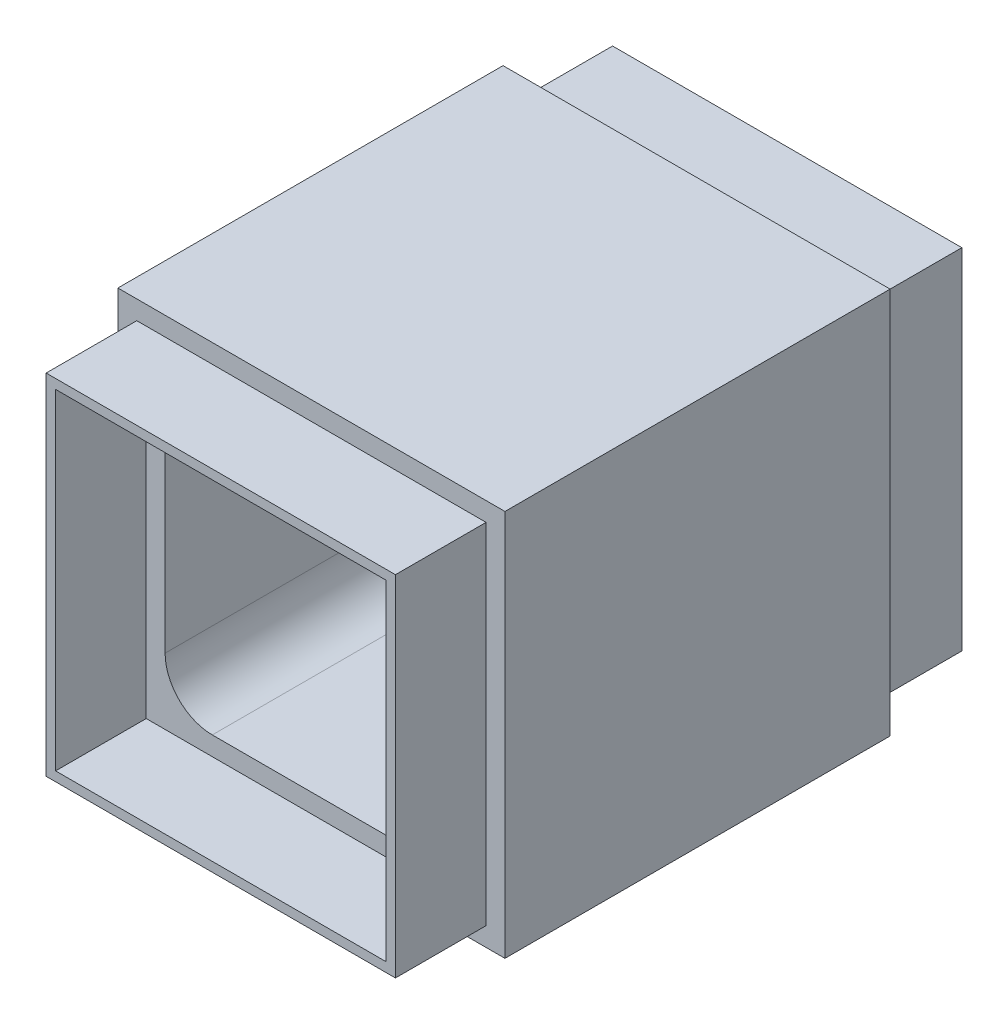
from build123d import *

# Parameters (mm, degrees)
SKETCH1_W           = 52.07
SKETCH1_H           = 52.07
BOSS_EXTRUDE1_DEPTH = 76.2
SKETCH2_W           = 39.37
SKETCH2_H           = 39.37
CUT_EXTRUDE1_DEPTH  = 106.967022229
SKETCH3_W           = 52.07
SKETCH3_H           = 52.07
SKETCH3_W_2         = 46.99
SKETCH3_H_2         = 46.99
SKETCH3_W_3         = 44.45
SKETCH3_H_3         = 44.45
SKETCH3_W_4         = 39.37
SKETCH3_H_4         = 39.37
CUT_EXTRUDE2_DEPTH  = 12.192
FILLET1_R           = 6.35


with BuildPart() as part:
    # Sketch1 → Boss-Extrude1 (new body)
    with BuildSketch(Plane.XY):
        with Locations((26.035, 26.035)):
            Rectangle(SKETCH1_W, SKETCH1_H)
    extrude(amount=-BOSS_EXTRUDE1_DEPTH)

    # Sketch2 → Cut-Extrude1 (cut, through all)
    with BuildSketch(Plane.XY):
        with Locations((26.035, 26.035)):
            Rectangle(SKETCH2_W, SKETCH2_H)
    extrude(amount=-CUT_EXTRUDE1_DEPTH, mode=Mode.SUBTRACT)

    # Sketch3 → Cut-Extrude2 (cut)
    # profile 1 of 2: a face of its own
    with BuildSketch(Plane.XY):
        with Locations((26.035, 26.035)):
            Rectangle(SKETCH3_W, SKETCH3_H)
        with Locations((26.035, 26.035)):
            Rectangle(SKETCH3_W_2, SKETCH3_H_2, mode=Mode.SUBTRACT)
    # profile 2 of 2: a face of its own
    with BuildSketch(Plane.XY):
        with Locations((26.035, 26.035)):
            Rectangle(SKETCH3_W_3, SKETCH3_H_3)
        with Locations((26.035, 26.035)):
            Rectangle(SKETCH3_W_4, SKETCH3_H_4, mode=Mode.SUBTRACT)
    cut_extrude2 = extrude(amount=-CUT_EXTRUDE2_DEPTH, mode=Mode.SUBTRACT)

    # Mirror1: Cut-Extrude2 across plane
    add(cut_extrude2.mirror(Plane(origin=(0, 0, -38.1), x_dir=(1, 0, 0), z_dir=(0, 0, -1))), mode=Mode.SUBTRACT)

    # Fillet1
    fillet1_edges = [part.edges().sort_by_distance(p)[0] for p in [
        (45.72, 6.35, -38.1),
        (6.35, 6.35, -38.1),
        (45.72, 45.72, -38.1),
        (6.35, 45.72, -38.1),
    ]]
    fillet(fillet1_edges, radius=FILLET1_R)


solid = part.part
